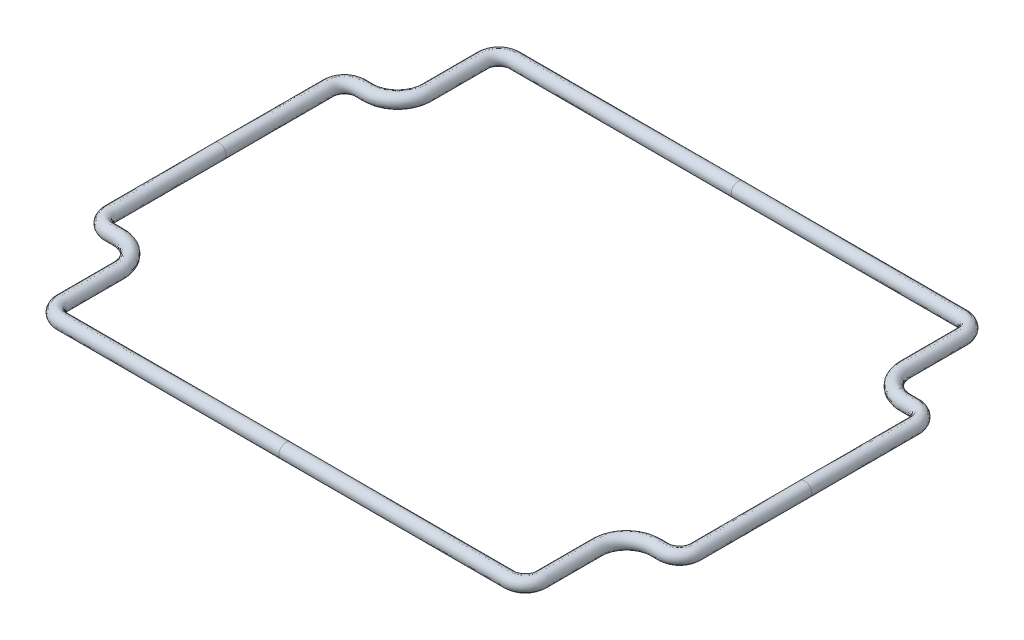
from build123d import *

# Parameters (mm, degrees)
QUARTERBELTPROFILE_R  = 1.3
QO_VM_COPY_1_SKETCH_R = 1.3


with BuildPart() as part:
    # Quarter O-Ring: sweep along a path in BeltPathS
    with BuildLine(Plane(origin=(0, 0, 0), x_dir=(1, 0, 0), z_dir=(0, 1, 0))) as quarter_o_ring_path:
        Line((0, 42.5), (-42, 42.5))
        ThreePointArc((-42, 42.5), (-44.121320344, 41.621320344), (-45, 39.5))
        Line((-45, 39.5), (-45, 29))
        ThreePointArc((-45, 29), (-46.610912703, 25.110912703), (-50.5, 23.5))
        Line((-50.5, 23.5), (-52, 23.5))
        ThreePointArc((-52, 23.5), (-54.121320344, 22.621320344), (-55, 20.5))
        Line((-55, 20.5), (-55, 0))
    # QuarterBeltProfile → Quarter O-Ring (sweep)
    with BuildSketch(Plane(origin=(0, 0, 0), x_dir=(-1, 0, 0), z_dir=(0, 0, -1))):
        with Locations((55, 0)):
            Circle(QUARTERBELTPROFILE_R)
    quarter_o_ring = sweep(path=quarter_o_ring_path.line)

    # QO HM: Quarter O-Ring across plane
    add(quarter_o_ring.mirror(Plane(origin=(0, 0, 0), x_dir=(0, 0, 1), z_dir=(1, 0, 0))))

    # QO VM: Quarter O-Ring across plane
    add(quarter_o_ring.mirror(Plane.XY))

    # QO VM copy 1: sweep along a path in QO VM copy 1 path
    with BuildLine(Plane(origin=(0, 0, 0), x_dir=(-1, 0, 0), z_dir=(0, 1, 0))) as qo_vm_copy_1_path:
        Line((0, 42.5), (-42, 42.5))
        ThreePointArc((-42, 42.5), (-44.121320344, 41.621320344), (-45, 39.5))
        Line((-45, 39.5), (-45, 29))
        ThreePointArc((-45, 29), (-46.610912703, 25.110912703), (-50.5, 23.5))
        Line((-50.5, 23.5), (-52, 23.5))
        ThreePointArc((-52, 23.5), (-54.121320344, 22.621320344), (-55, 20.5))
        Line((-55, 20.5), (-55, 0))
    # QO VM copy 1 sketch → QO VM copy 1 (sweep)
    with BuildSketch(Plane.XY):
        with Locations((55, 0)):
            Circle(QO_VM_COPY_1_SKETCH_R)
    sweep(path=qo_vm_copy_1_path.line)


solid = part.part
